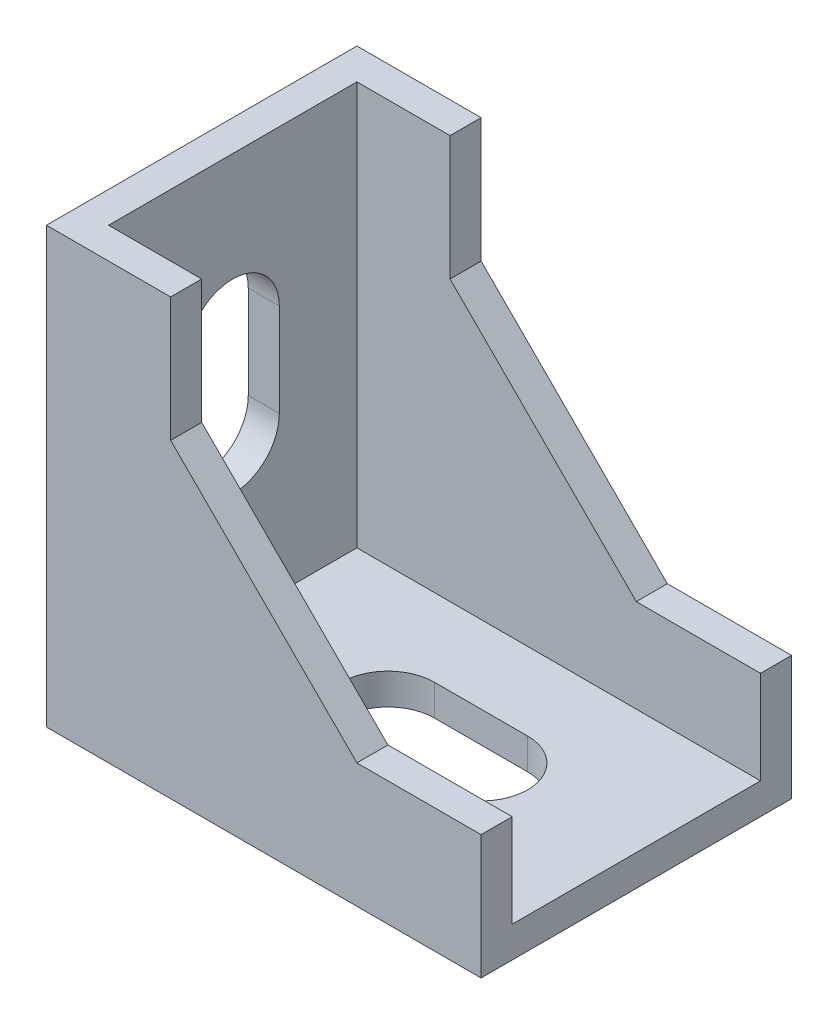
from build123d import *

# Parameters (mm, degrees)
BOSS_EXTRUDE1_DEPTH = 20
CUT_EXTRUDE1_START  = -26
SKETCH2_W           = 16
SKETCH2_H           = 20
SKETCH2_H_2         = 6
CUT_EXTRUDE1_DEPTH  = 26
SKETCH3_R           = 3
CUT_EXTRUDE2_DEPTH  = 2.000000064


with BuildPart() as part:
    # Sketch1 → Boss-Extrude1 (new body)
    with BuildSketch(Plane.XY):
        Polygon((0, 0), (0, 28), (8, 28), (8, 20), (20, 8), (28, 8), (28, 0), align=None)
    extrude(amount=BOSS_EXTRUDE1_DEPTH)

    # Sketch2 → Cut-Extrude1 (cut)
    with BuildSketch(Plane(origin=(28, 0, 0), x_dir=(0, 0, -1), z_dir=(1, 0, 0)).offset(CUT_EXTRUDE1_START)):
        with Locations((-10, 18)):
            Rectangle(SKETCH2_W, SKETCH2_H)
        with Locations((-10, 5)):
            Rectangle(SKETCH2_W, SKETCH2_H_2)
    extrude(amount=CUT_EXTRUDE1_DEPTH, mode=Mode.SUBTRACT)

    # Sketch3 → Cut-Extrude2 (cut)
    with BuildSketch(Plane(origin=(2.000000064, 0, 0), x_dir=(0, 0, -1), z_dir=(1, 0, 0))):
        with Locations((-10, 18)):
            Circle(SKETCH3_R)
        with BuildLine():
            ThreePointArc((-10, 15), (-12.121320344, 15.878679656), (-13, 18))
            Line((-13, 18), (-13, 12))
            ThreePointArc((-13, 12), (-12.121320344, 14.121320344), (-10, 15))
        make_face()
        with BuildLine():
            Line((-7, 12), (-7, 18))
            ThreePointArc((-7, 18), (-7.878679656, 15.878679656), (-10, 15))
            ThreePointArc((-10, 15), (-7.878679656, 14.121320344), (-7, 12))
        make_face()
        with Locations((-10, 12)):
            Circle(SKETCH3_R)
    cut_extrude2 = extrude(amount=-CUT_EXTRUDE2_DEPTH, mode=Mode.SUBTRACT)

    # Mirror2: Cut-Extrude2 across plane
    add(cut_extrude2.mirror(Plane(origin=(0, 0, 0), x_dir=(0, 0, 1), z_dir=(0.7071067811865438, -0.7071067811865512, 0))), mode=Mode.SUBTRACT)


solid = part.part
